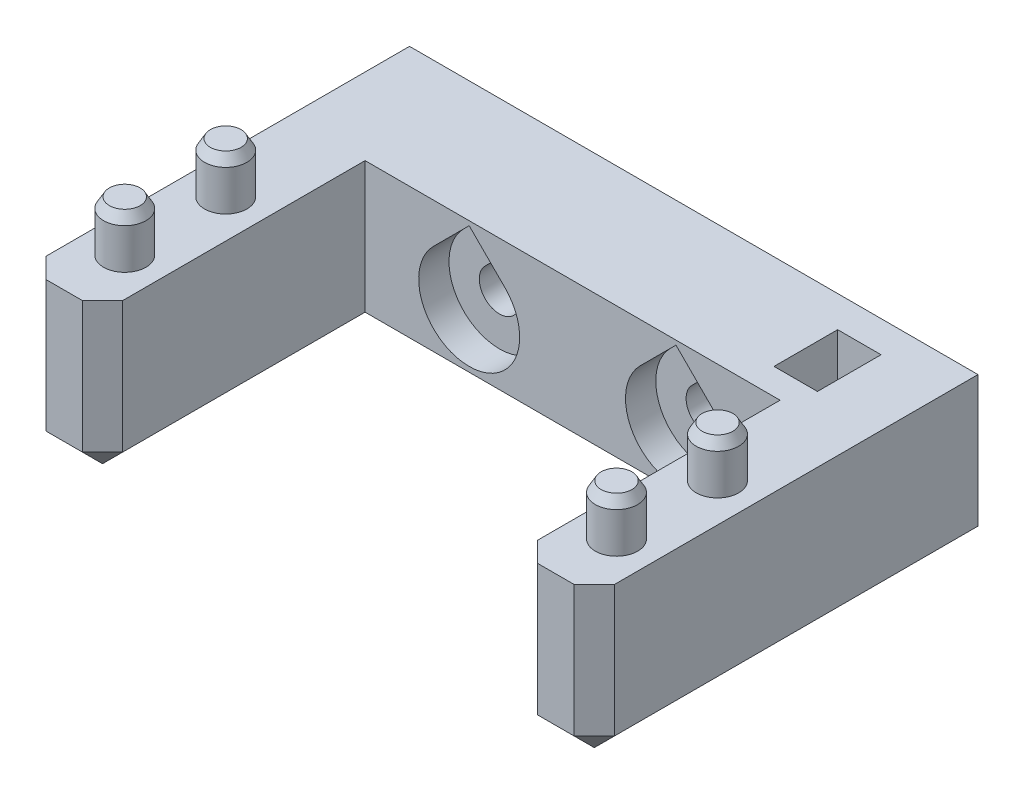
from build123d import *

# Parameters (mm, degrees)
SKETCH2_R             = 2.1
BOSS_EXTRUDE1_DEPTH   = 5
BOSS_EXTRUDE1_2_DEPTH = 5
BOSS_EXTRUDE1_3_DEPTH = 5
BOSS_EXTRUDE1_4_DEPTH = 5
SKETCH3_W             = 7.6
SKETCH3_H             = 26
BOSS_EXTRUDE2_DEPTH   = 15
CHAMFER1_SIZE         = 1
CHAMFER1_SIZE2        = 0.577350269
CHAMFER1_PART_2_SIZE  = 1
CHAMFER1_PART_2_SIZE2 = 0.577350269
CHAMFER2_SIZE         = 1
CHAMFER2_SIZE2        = 0.577350269
CHAMFER2_PART_2_SIZE  = 1
CHAMFER2_PART_2_SIZE2 = 0.577350269
SKETCH4_W             = 56.3
SKETCH4_H             = 12
BOSS_EXTRUDE3_DEPTH   = 15
CUT_EXTRUDE1_DEPTH    = 42.151215049
CUT_EXTRUDE2_DEPTH    = 3
CHAMFER7_SIZE         = 2
SKETCH7_W             = 4.3
SKETCH7_H             = 6.3
CUT_EXTRUDE3_DEPTH    = 42.790220148


with BuildPart() as part:
    # Sketch2 → Boss-Extrude1 (new body)
    with BuildSketch(Plane(origin=(0, 0, 0), x_dir=(1, 0, 0), z_dir=(0, 1, 0))):
        with Locations(Location((-24.35, 5, 0), (0, 0, 270))):
            Circle(SKETCH2_R)
    extrude(amount=BOSS_EXTRUDE1_DEPTH)



with BuildPart() as body_2:
    # Sketch2 → Boss-Extrude1 2 (new body)
    with BuildSketch(Plane(origin=(0, 0, 0), x_dir=(1, 0, 0), z_dir=(0, 1, 0))):
        with Locations(Location((-24.35, -5, 0), (0, 0, 270))):
            Circle(SKETCH2_R)
    extrude(amount=BOSS_EXTRUDE1_2_DEPTH)


with BuildPart() as body_3:
    # Sketch2 → Boss-Extrude1 3 (new body)
    with BuildSketch(Plane(origin=(0, 0, 0), x_dir=(1, 0, 0), z_dir=(0, 1, 0))):
        with Locations(Location((24.35, -5, 0), (0, 0, 90))):
            Circle(SKETCH2_R)
    extrude(amount=BOSS_EXTRUDE1_3_DEPTH)


with BuildPart() as body_4:
    # Sketch2 → Boss-Extrude1 4 (new body)
    with BuildSketch(Plane(origin=(0, 0, 0), x_dir=(1, 0, 0), z_dir=(0, 1, 0))):
        with Locations(Location((24.35, 5, 0), (0, 0, 90))):
            Circle(SKETCH2_R)
    extrude(amount=BOSS_EXTRUDE1_4_DEPTH)


with BuildPart() as part_1:
    add(part.part)

    add(body_2.part)  # Boss-Extrude2 merges body 2

    add(body_3.part)  # Boss-Extrude2 merges body 3

    add(body_4.part)  # Boss-Extrude2 merges body 4
    # Sketch3 → Boss-Extrude2 (add)
    with BuildSketch(Plane(origin=(0, 0, 0), x_dir=(1, 0, 0), z_dir=(0, 1, 0))):
        with Locations((-24.35, 2)):
            Rectangle(SKETCH3_W, SKETCH3_H)
        with Locations((24.35, 2)):
            Rectangle(SKETCH3_W, SKETCH3_H)
    extrude(amount=-BOSS_EXTRUDE2_DEPTH)

    # Chamfer1
    chamfer1_edges = [part_1.edges().sort_by_distance(p)[0] for p in [
        (-24.35, 5, 2.9),
    ]]
    chamfer1_side = [part_1.faces().sort_by_distance(p)[0] for p in [
        (-24.35, 2.5, 2.9),
    ]]
    chamfer(chamfer1_edges, length=CHAMFER1_SIZE, length2=CHAMFER1_SIZE2, reference=chamfer1_side[0])

    # Chamfer1 part 2
    chamfer1_part_2_edges = [part_1.edges().sort_by_distance(p)[0] for p in [
        (-24.35, 5, -7.1),
    ]]
    chamfer1_part_2_side = [part_1.faces().sort_by_distance(p)[0] for p in [
        (-24.35, 2.5, -7.1),
    ]]
    chamfer(chamfer1_part_2_edges, length=CHAMFER1_PART_2_SIZE, length2=CHAMFER1_PART_2_SIZE2, reference=chamfer1_part_2_side[0])

    # Chamfer2
    chamfer2_edges = [part_1.edges().sort_by_distance(p)[0] for p in [
        (24.35, 5, -2.9),
    ]]
    chamfer2_side = [part_1.faces().sort_by_distance(p)[0] for p in [
        (24.35, 2.5, -2.9),
    ]]
    chamfer(chamfer2_edges, length=CHAMFER2_SIZE, length2=CHAMFER2_SIZE2, reference=chamfer2_side[0])

    # Chamfer2 part 2
    chamfer2_part_2_edges = [part_1.edges().sort_by_distance(p)[0] for p in [
        (24.35, 5, 7.1),
    ]]
    chamfer2_part_2_side = [part_1.faces().sort_by_distance(p)[0] for p in [
        (24.35, 2.5, 7.1),
    ]]
    chamfer(chamfer2_part_2_edges, length=CHAMFER2_PART_2_SIZE, length2=CHAMFER2_PART_2_SIZE2, reference=chamfer2_part_2_side[0])

    # Sketch4 → Boss-Extrude3 (add)
    with BuildSketch(Plane(origin=(0, 0, 0), x_dir=(1, 0, 0), z_dir=(0, 1, 0))):
        with Locations((0, 21)):
            Rectangle(SKETCH4_W, SKETCH4_H)
    extrude(amount=-BOSS_EXTRUDE3_DEPTH)

    # Sketch5 → Cut-Extrude1 (cut, through all)
    with BuildSketch(Plane.XY.offset(-15)):
        with BuildLine():
            Line((-11.654372972, -6.085786438), (-10.24015941, -4.671572875))
            Line((-10.24015941, -4.671572875), (-8.825945848, -6.085786438))
            ThreePointArc((-8.825945848, -6.085786438), (-10.24015941, -9.5), (-11.654372972, -6.085786438))
        make_face()
        with BuildLine():
            ThreePointArc((11.654372972, -6.085786438), (10.24015941, -9.5), (8.825945848, -6.085786438))
            Line((8.825945848, -6.085786438), (10.24015941, -4.671572875))
            Line((10.24015941, -4.671572875), (11.654372972, -6.085786438))
        make_face()
    extrude(amount=-CUT_EXTRUDE1_DEPTH, mode=Mode.SUBTRACT)

    # Sketch6 → Cut-Extrude2 (cut)
    with BuildSketch(Plane.XY.offset(-15)):
        with BuildLine():
            Line((-6.704625504, -3.964466094), (-10.24015941, -0.428932188))
            Line((-10.24015941, -0.428932188), (-13.775693316, -3.964466094))
            ThreePointArc((-13.775693316, -3.964466094), (-10.24015941, -12.5), (-6.704625504, -3.964466094))
        make_face()
        with BuildLine():
            Line((13.775693316, -3.964466094), (10.24015941, -0.428932188))
            Line((10.24015941, -0.428932188), (6.704625504, -3.964466094))
            ThreePointArc((6.704625504, -3.964466094), (10.24015941, -12.5), (13.775693316, -3.964466094))
        make_face()
    extrude(amount=-CUT_EXTRUDE2_DEPTH, mode=Mode.SUBTRACT)

    # Chamfer7
    chamfer7_edges = [part_1.edges().sort_by_distance(p)[0] for p in [
        (0, -15, -15),
        (28.15, -15, -8),
        (0, -15, -27),
        (24.35, -15, 11),
        (28.15, -7.5, 11),
        (20.55, -15, -2),
        (20.55, -7.5, 11),
        (-20.55, -15, -2),
        (-24.35, -15, 11),
        (-20.55, -7.5, 11),
        (-28.15, -15, -8),
        (-28.15, -7.5, 11),
    ]]
    chamfer(chamfer7_edges, length=CHAMFER7_SIZE)

    # Sketch7 → Cut-Extrude3 (cut, through all)
    with BuildSketch(Plane(origin=(0, 0, 0), x_dir=(1, 0, 0), z_dir=(0, 1, 0))):
        with Locations((19.5, 20.75)):
            Rectangle(SKETCH7_W, SKETCH7_H)
    extrude(amount=-CUT_EXTRUDE3_DEPTH, mode=Mode.SUBTRACT)


solid = part_1.part
